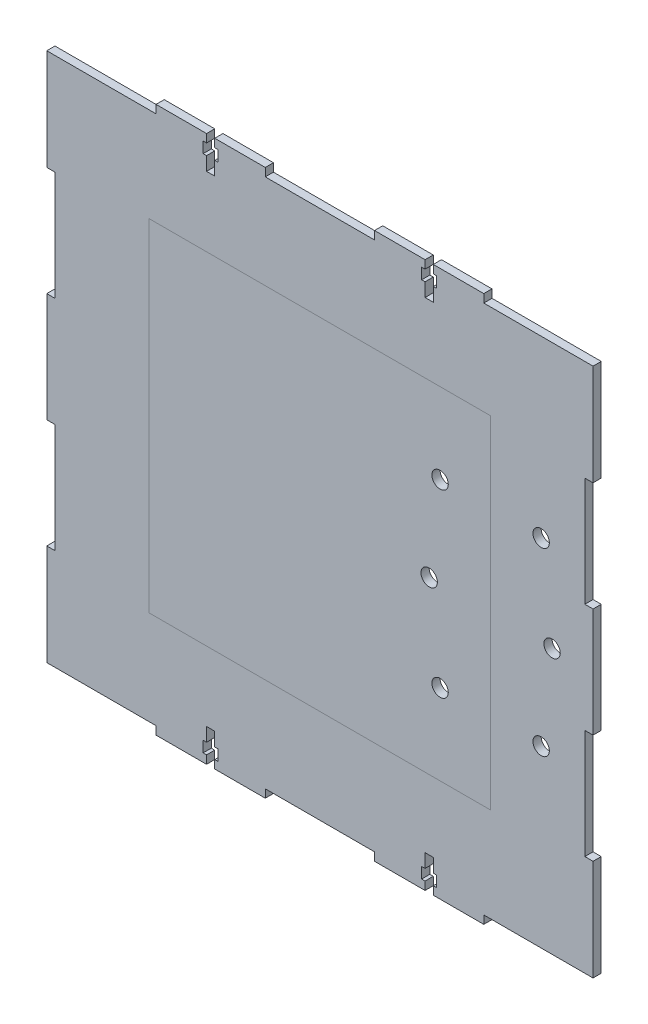
from build123d import *

# Parameters (mm, degrees)
SKETCH_1_W      = 125
SKETCH_1_H      = 125
SKETCH_1_R      = 3
EXTRUDE_2_DEPTH = 3
SKETCH_1_6_W    = 125
SKETCH_1_6_H    = 125
SKETCH_1_6_R    = 3
EXTRUDE_4_DEPTH = 3


with BuildPart() as part:
    # 草图1 → 凸台-拉伸2 (new body)
    with BuildSketch(Plane.XY):
        Polygon((120, -3), (80, -3), (80, 0), (61.5, 0), (61.5, -3), (62.75, -3), (62.75, -7), (61.5, -7), (61.5, -12), (58.5, -12), (58.5, -7), (57.25, -7), (57.25, -3), (58.5, -3), (58.5, 0), (40, 0), (40, -3), (0, -3), (0, -40), (3, -40), (3, -80), (0, -80), (0, -120), (3, -120), (3, -160), (0, -160), (0, -197), (40, -197), (40, -200), (58.5, -200), (58.5, -197), (57.25, -197), (57.25, -193), (58.5, -193), (58.5, -188), (61.5, -188), (61.5, -193), (62.75, -193), (62.75, -197), (61.5, -197), (61.5, -200), (80, -200), (80, -197), (120, -197), (120, -200), (138.5, -200), (138.5, -197), (137.25, -197), (137.25, -193), (138.5, -193), (138.5, -188), (141.5, -188), (141.5, -193), (142.75, -193), (142.75, -197), (141.5, -197), (141.5, -200), (160, -200), (160, -197), (200, -197), (200, -160), (197, -160), (197, -120), (200, -120), (200, -80), (197, -80), (197, -40), (200, -40), (200, -3), (160, -3), (160, 0), (141.5, 0), (141.5, -3), (142.75, -3), (142.75, -7), (141.5, -7), (141.5, -12), (138.5, -12), (138.5, -7), (137.25, -7), (137.25, -3), (138.5, -3), (138.5, 0), (120, 0), align=None)
        with Locations((100, -100)):
            Rectangle(SKETCH_1_W, SKETCH_1_H, mode=Mode.SUBTRACT)
        with Locations((185, -100)):
            Circle(SKETCH_1_R, mode=Mode.SUBTRACT)
        with Locations((181, -67)):
            Circle(SKETCH_1_R, mode=Mode.SUBTRACT)
        with Locations((181, -133)):
            Circle(SKETCH_1_R, mode=Mode.SUBTRACT)
    extrude(amount=EXTRUDE_2_DEPTH)


with BuildPart() as body_2:
    # 草图1<6> → 凸台-拉伸4 (new body)
    with BuildSketch(Plane.XY):
        with Locations((100, -100)):
            Rectangle(SKETCH_1_6_W, SKETCH_1_6_H)
        with Locations((140, -100)):
            Circle(SKETCH_1_6_R, mode=Mode.SUBTRACT)
        with Locations((144, -67)):
            Circle(SKETCH_1_6_R, mode=Mode.SUBTRACT)
        with Locations((144, -133)):
            Circle(SKETCH_1_6_R, mode=Mode.SUBTRACT)
    extrude(amount=EXTRUDE_4_DEPTH)


solid = Compound([part.part, body_2.part])
